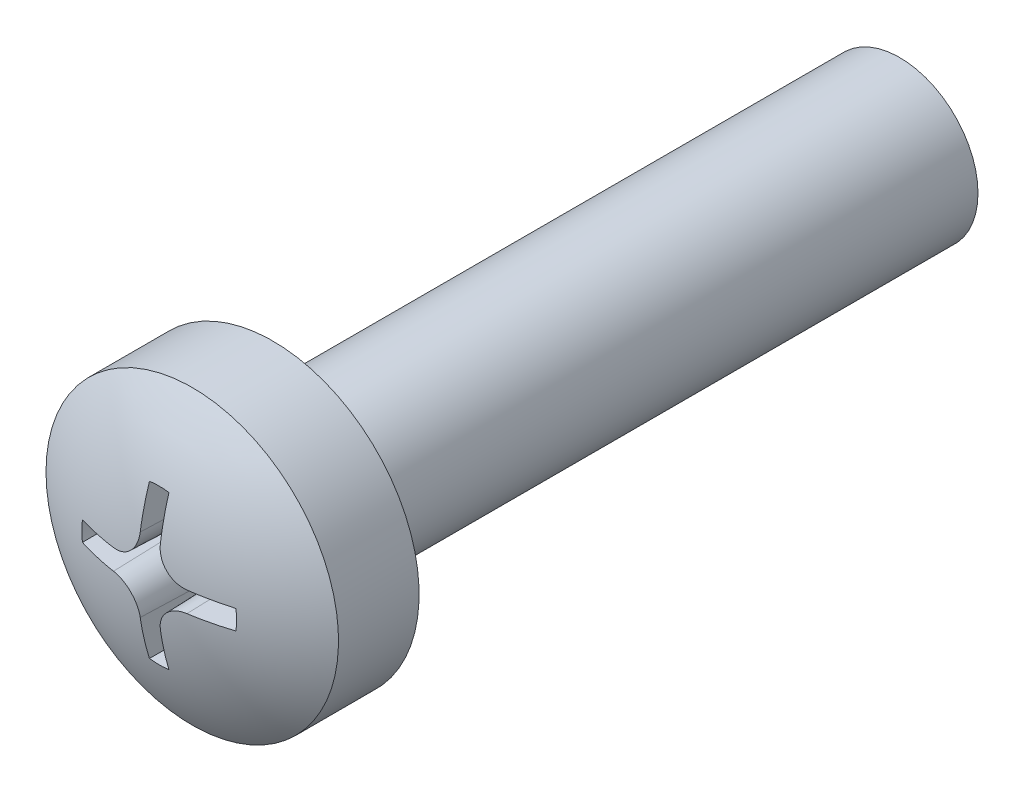
from build123d import *

# Parameters (mm, degrees)
BASE_EXTRUDE_DEPTH      = 12
BASE_EXTRUDE_DEPTH_BACK = 0.0001
SKETCH1_R               = 1.5
CUT_EXTRUDE1_DEPTH      = 1.799999969
CUT_EXTRUDE1_TAPER      = 2


with BuildPart() as part:
    # Sketch1 → Base-Extrude (new, two sides: drawn at the far end of the back side and taken through both)
    with BuildSketch(Plane.XY.offset(-BASE_EXTRUDE_DEPTH_BACK)):
        Circle(SKETCH1_R)
    extrude(amount=BASE_EXTRUDE_DEPTH + BASE_EXTRUDE_DEPTH_BACK)

    # Sketch6 → Boss-Revolve2 (revolve)
    with BuildSketch(Plane(origin=(0, 0, 0), x_dir=(1, 0, 0), z_dir=(0, 1, 0))):
        with BuildLine():
            Line((0, -12), (2.7999999, -12))
            Line((2.7999999, -12), (2.7999999, -13.54246308))
            ThreePointArc((2.7999999, -13.54246308), (1.46418655, -14.180811406), (0, -14.4))
            Line((0, -14.4), (0, -12))
        make_face()
    revolve(axis=Axis((0, 0, -0.393620135), (0, 0, 1)))

    # Sketch7 → Cut-Extrude1 (cut)
    with BuildSketch(Plane(origin=(0, 0, 14.7000001), x_dir=(-1, 0, 0), z_dir=(0, 0, -1))):
        with BuildLine():
            ThreePointArc((0.205000004, 1.48592565), (0, 1.500000013), (-0.205000004, 1.48592565))
            Line((-0.205000004, 1.48592565), (-0.205000004, 0.708178558))
            ThreePointArc((-0.205000004, 0.708178558), (-0.35072876, 0.355344481), (-0.702967546, 0.208182689))
            Line((-0.702967546, 0.208182689), (-1.48592565, 0.205000004))
            ThreePointArc((-1.48592565, 0.205000004), (-1.500000013, 0), (-1.48592565, -0.205000004))
            Line((-1.48592565, -0.205000004), (-0.702967546, -0.208182689))
            ThreePointArc((-0.702967546, -0.208182689), (-0.35072876, -0.355344481), (-0.205000004, -0.708178558))
            Line((-0.205000004, -0.708178558), (-0.205000004, -1.48592565))
            ThreePointArc((-0.205000004, -1.48592565), (0, -1.500000013), (0.205000004, -1.48592565))
            Line((0.205000004, -1.48592565), (0.205000004, -0.708178558))
            ThreePointArc((0.205000004, -0.708178558), (0.35072876, -0.355344481), (0.702967546, -0.208182689))
            Line((0.702967546, -0.208182689), (1.48592565, -0.205000004))
            ThreePointArc((1.48592565, -0.205000004), (1.500000013, 0), (1.48592565, 0.205000004))
            Line((1.48592565, 0.205000004), (0.702967546, 0.208182689))
            ThreePointArc((0.702967546, 0.208182689), (0.35072876, 0.355344481), (0.205000004, 0.708178558))
            Line((0.205000004, 0.708178558), (0.205000004, 1.48592565))
        make_face()
    extrude(amount=CUT_EXTRUDE1_DEPTH, taper=CUT_EXTRUDE1_TAPER, mode=Mode.SUBTRACT)


solid = part.part
